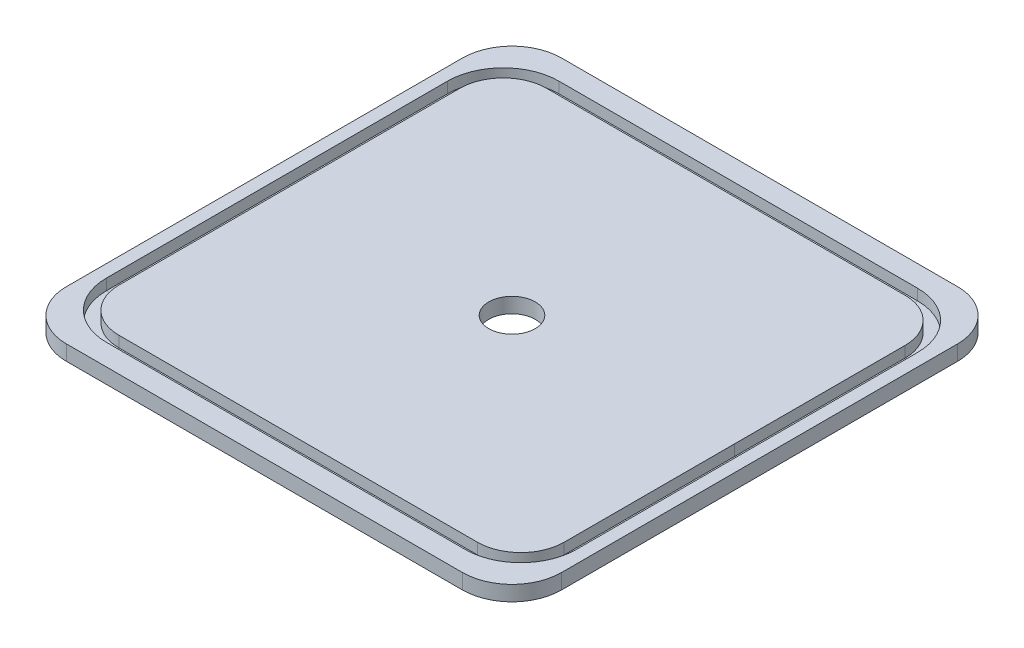
from build123d import *

# Parameters (mm, degrees)
MAIN_BODY_DEPTH      = 1.94183
SKETCH29_R           = 5.953125
PNEUMATICMOUNT_DEPTH = 3.88366
ORINGINSERTPROFILE_W = 3.17754
ORINGINSERTPROFILE_H = 2.82448


with BuildPart() as part:
    # Sketch1 → main body (new, symmetric)
    with BuildSketch(Plane(origin=(0, 0, 0), x_dir=(1, 0, 0), z_dir=(0, 1, 0))):
        with BuildLine():
            Line((-63.5, 50.8), (-63.5, -50.8))
            ThreePointArc((-63.5, -50.8), (-59.780256121, -59.780256121), (-50.8, -63.5))
            Line((-50.8, -63.5), (50.8, -63.5))
            ThreePointArc((50.8, -63.5), (59.780256121, -59.780256121), (63.5, -50.8))
            Line((63.5, -50.8), (63.5, 50.8))
            ThreePointArc((63.5, 50.8), (59.780256121, 59.780256121), (50.8, 63.5))
            Line((50.8, 63.5), (-50.8, 63.5))
            ThreePointArc((-50.8, 63.5), (-59.780256121, 59.780256121), (-63.5, 50.8))
        make_face()
    extrude(amount=MAIN_BODY_DEPTH, both=True)

    # Sketch29 → PneumaticMount (cut)
    with BuildSketch(Plane(origin=(0, 1.94183, 0), x_dir=(1, 0, 0), z_dir=(0, 1, 0))):
        with Locations(Location((0, 0, 0), (0, 0, 270))):
            Circle(SKETCH29_R)
    extrude(amount=-PNEUMATICMOUNT_DEPTH, mode=Mode.SUBTRACT)

    # O-RingInsert: sweep along a path in ORingInsertPath
    with BuildLine(Plane(origin=(0, 1.94183, 0), x_dir=(1, 0, 0), z_dir=(0, 1, 0))) as o_ringinsert_path:
        Line((-45.992219207, -56.4388), (45.992219207, -56.4388))
        ThreePointArc((45.992219207, -56.4388), (54.972475328, -52.719056121), (58.692219207, -43.7388))
        Line((58.692219207, -43.7388), (58.692219207, 43.7388))
        ThreePointArc((58.692219207, 43.7388), (54.972475328, 52.719056121), (45.992219207, 56.4388))
        Line((45.992219207, 56.4388), (-45.992219207, 56.4388))
        ThreePointArc((-45.992219207, 56.4388), (-54.972475328, 52.719056121), (-58.692219207, 43.7388))
        Line((-58.692219207, 43.7388), (-58.692219207, -43.7388))
        ThreePointArc((-58.692219207, -43.7388), (-54.972475328, -52.719056121), (-45.992219207, -56.4388))
    # ORingInsertProfile → O-RingInsert (sweep, cut)
    with BuildSketch(Plane.XY):
        with Locations((58.692219207, 0.52959)):
            Rectangle(ORINGINSERTPROFILE_W, ORINGINSERTPROFILE_H)
    sweep(path=o_ringinsert_path.line, mode=Mode.SUBTRACT)


solid = part.part
